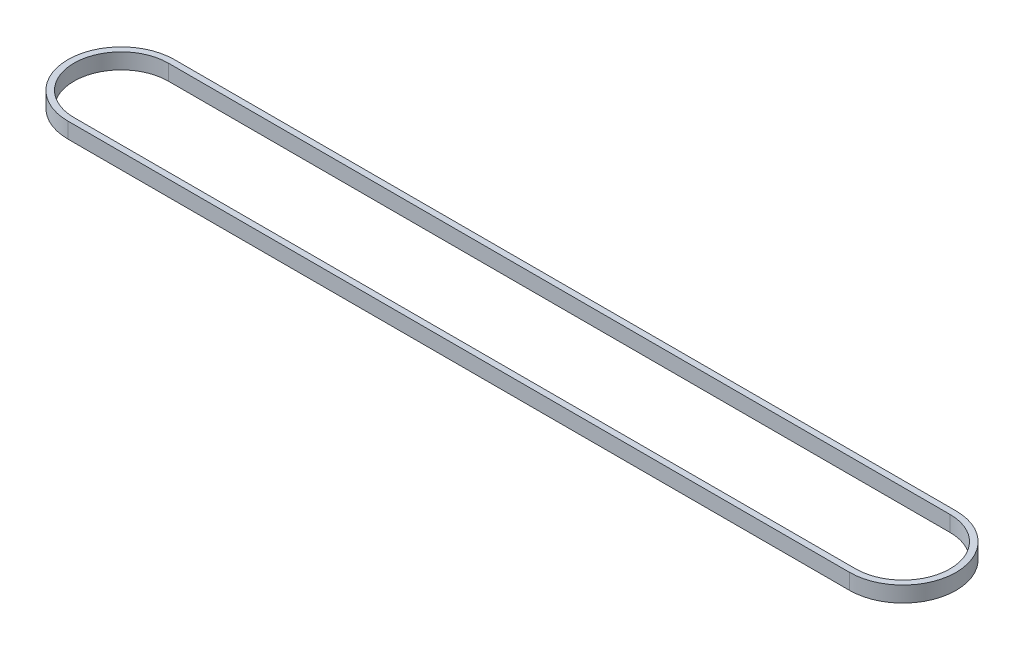
from build123d import *

# Parameters (mm, degrees)
BOSS_EXTRUDE1_DEPTH = 9


with BuildPart() as part:
    # Sketch1 → Boss-Extrude1 (new body)
    # profile 1 of 2: a face of its own
    with BuildSketch(Plane(origin=(0, 0, 0), x_dir=(1, 0, 0), z_dir=(0, 1, 0))):
        with BuildLine():
            Line((0, 30.65), (450, 30.65))
            ThreePointArc((450, 30.65), (480.65, 0), (450, -30.65))
            Line((450, -30.65), (0, -30.65))
            ThreePointArc((0, -30.65), (-30.65, 0), (0, 30.65))
        make_face()
        with BuildLine():
            ThreePointArc((450, -28.65), (478.65, 0), (450, 28.65))
            Line((450, 28.65), (0, 28.65))
            ThreePointArc((0, 28.65), (-28.65, 0), (0, -28.65))
            Line((0, -28.65), (450, -28.65))
        make_face(mode=Mode.SUBTRACT)
    # profile 2 of 2: a face of its own
    with BuildSketch(Plane(origin=(0, 0, 0), x_dir=(1, 0, 0), z_dir=(0, 1, 0))):
        with BuildLine():
            Line((0, -28.65), (450, -28.65))
            ThreePointArc((450, -28.65), (478.65, 0), (450, 28.65))
            Line((450, 28.65), (0, 28.65))
            ThreePointArc((0, 28.65), (-28.65, 0), (0, -28.65))
        make_face()
        with BuildLine():
            ThreePointArc((0, 27.15), (-27.15, 0), (0, -27.15))
            Line((0, -27.15), (450, -27.15))
            ThreePointArc((450, -27.15), (477.15, 0), (450, 27.15))
            Line((450, 27.15), (0, 27.15))
        make_face(mode=Mode.SUBTRACT)
    extrude(amount=BOSS_EXTRUDE1_DEPTH)


solid = part.part
